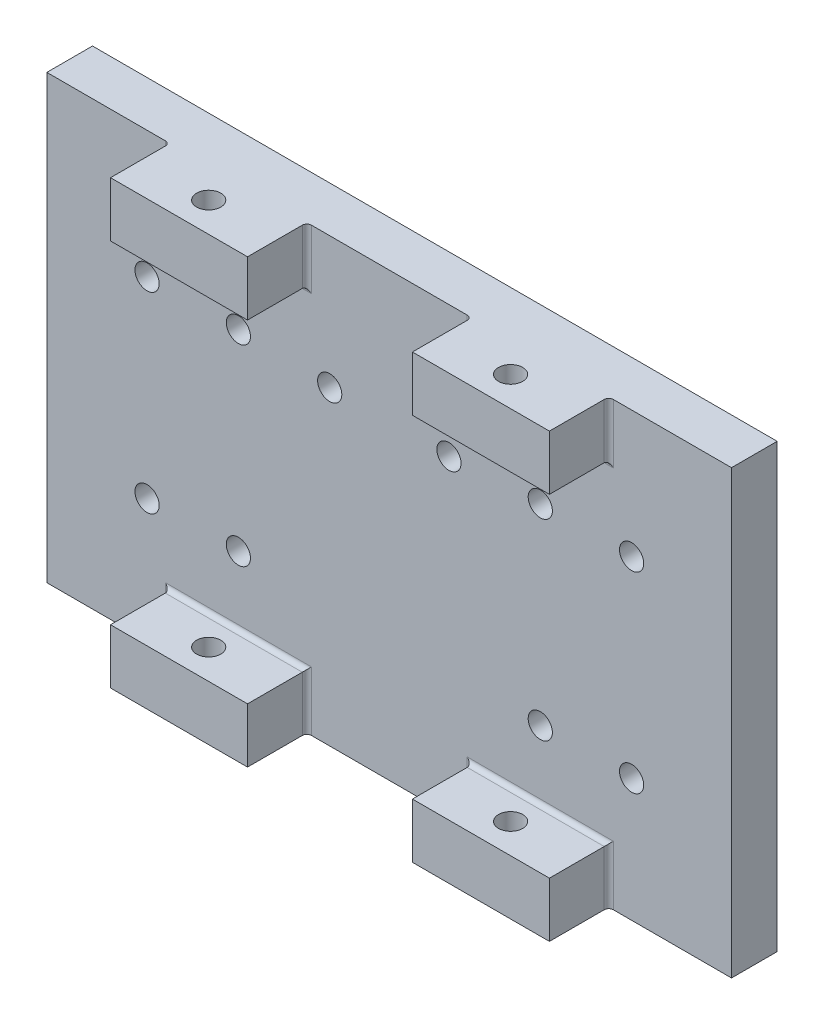
from build123d import *

# Parameters (mm, degrees)
SKETCH3_W               = 149.929020718
SKETCH3_H               = 96.78
SKETCH3_R               = 2.65
BOSS_EXTRUDE1_DEPTH     = 10
SKETCH4_W               = 30
SKETCH4_H               = 12
BOSS_EXTRUDE4_DEPTH     = 13
CUT_EXTRUDE1_DEPTH      = 116.506286536
CUT_EXTRUDE1_DEPTH_BACK = 116.506286536
SKETCH8_R               = 2.65
FILLET1_R               = 1


with BuildPart() as part:
    # Sketch3 → Boss-Extrude1 (new body)
    with BuildSketch(Plane.XY):
        with Locations((-0.035848502, 4.44)):
            Rectangle(SKETCH3_W, SKETCH3_H)
        with Locations((-53.055358861, -17.005)):
            Circle(SKETCH3_R, mode=Mode.SUBTRACT)
        with Locations((-33.055, -17.005)):
            Circle(SKETCH3_R, mode=Mode.SUBTRACT)
        with Locations((33.055, -17.005)):
            Circle(SKETCH3_R, mode=Mode.SUBTRACT)
        with Locations((53.054641139, -17.005)):
            Circle(SKETCH3_R, mode=Mode.SUBTRACT)
        with Locations((-53.055358861, 25.027361408)):
            Circle(SKETCH3_R, mode=Mode.SUBTRACT)
        with Locations((-33.055, 25.027361408)):
            Circle(SKETCH3_R, mode=Mode.SUBTRACT)
        with Locations((-13.055, 24.027361408)):
            Circle(SKETCH3_R, mode=Mode.SUBTRACT)
        with Locations((13.055, 24.027361408)):
            Circle(SKETCH3_R, mode=Mode.SUBTRACT)
        with Locations((33.055, 25.027361408)):
            Circle(SKETCH3_R, mode=Mode.SUBTRACT)
        with Locations((53.054641139, 25.027361408)):
            Circle(SKETCH3_R, mode=Mode.SUBTRACT)
    extrude(amount=BOSS_EXTRUDE1_DEPTH)

    # Sketch4 → Boss-Extrude4 (add)
    with BuildSketch(Plane.XY.offset(10)):
        Polygon((-48.055, 40.83), (-33.055, 40.83), (-18.055, 40.83), (-18.055, 52.83), (-48.055, 52.83), align=None)
        with Locations((33.055, 46.83)):
            Rectangle(SKETCH4_W, SKETCH4_H)
        with Locations((-33.055, -37.95)):
            Rectangle(SKETCH4_W, SKETCH4_H)
        with Locations((33.055, -37.95)):
            Rectangle(SKETCH4_W, SKETCH4_H)
    extrude(amount=BOSS_EXTRUDE4_DEPTH)

    # Sketch8 → Cut-Extrude1 (cut, two sides: drawn at the far end of the back side and taken through both)
    with BuildSketch(Plane(origin=(0, -31.95, 0), x_dir=(1, 0, 0), z_dir=(0, 1, 0)).offset(-CUT_EXTRUDE1_DEPTH_BACK)):
        with Locations(Location((-33.055, -16.5, 0), (0, 0, 270))):
            Circle(SKETCH8_R)
        with Locations(Location((33.055, -16.5, 0), (0, 0, 270))):
            Circle(SKETCH8_R)
    extrude(amount=CUT_EXTRUDE1_DEPTH + CUT_EXTRUDE1_DEPTH_BACK, mode=Mode.SUBTRACT)

    # Fillet1
    fillet1_edges = [part.edges().sort_by_distance(p)[0] for p in [
        (-33.055, 40.83, 10),
        (-18.055, 46.83, 10),
        (-48.055, 46.83, 10),
        (33.055, 40.83, 10),
        (48.055, 46.83, 10),
        (18.055, 46.83, 10),
        (-18.055, -37.95, 10),
        (-33.055, -31.95, 10),
        (-48.055, -37.95, 10),
        (48.055, -37.95, 10),
        (33.055, -31.95, 10),
        (18.055, -37.95, 10),
    ]]
    fillet(fillet1_edges, radius=FILLET1_R)


solid = part.part
